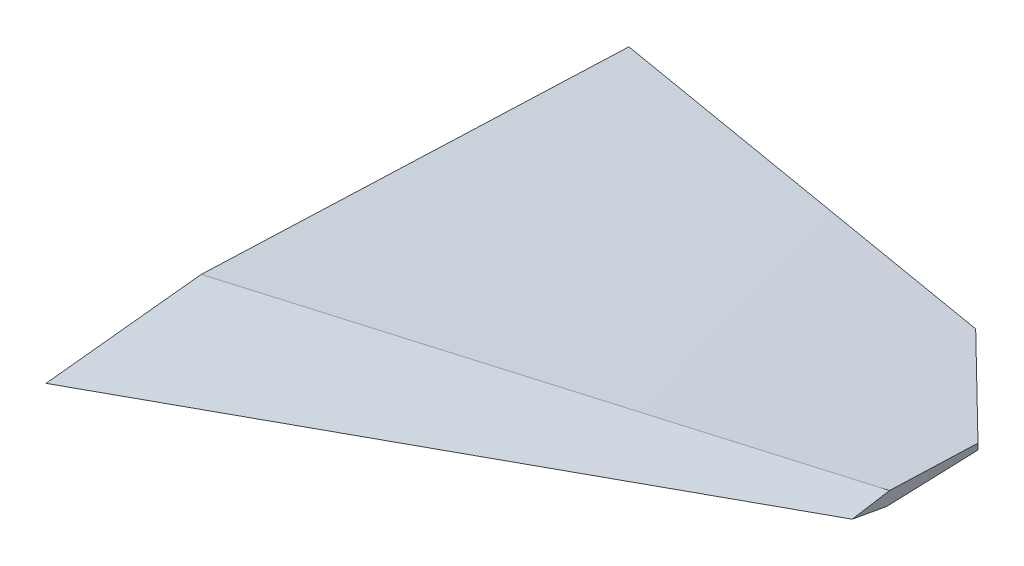
from build123d import *

# Parameters (mm, degrees)
SPLIT1_SURFACE_1_BACK  = 3090.119
SPLIT1_SURFACE_1_DEPTH = 6180.238


with BuildPart() as part:
    # Sketch1 → Loft1 section 0
    with BuildSketch(Plane(origin=(1079.999178552, 0, 0), x_dir=(0, 0, -1), z_dir=(1, 0, 0))):
        with BuildLine():
            Line((4952.5, 1865), (5602.5, 1935))
            Line((5602.5, 1935), (7392.5, 1865))
            Line((7392.5, 1865), (5602.5, 1795))
            Line((5602.5, 1795), (4952.5, 1865))
        make_face()
    # Sketch3 → Loft1 section 1
    with BuildSketch(Plane(origin=(2914.999178552, 1520, 0), x_dir=(0, 0, -1), z_dir=(0.9827811204575816, -0.18477356215687504, 0))):
        with BuildLine():
            Line((6492.5, 0), (6642.5, 32.5))
            Line((6642.5, 32.5), (7367.5, 0))
            Line((7367.5, 0), (6642.5, -32.5))
            Line((6642.5, -32.5), (6492.5, 0))
        make_face()
    loft()

    # Split1: cut with a surface, the side behind it stays
    # Split1 surface: a surface, the sketch's curves swept straight by 6180.238 mm
    with BuildLine(Plane(origin=(0, 0, 0), x_dir=(1, 0, 0), z_dir=(0, 1, 0)).offset(-SPLIT1_SURFACE_1_BACK), mode=Mode.PRIVATE) as split1_surface_1_path:
        Line((2264, 7652.5), (4524, 5452.5))
    split1_surface_1 = Shell.extrude(split1_surface_1_path.wire(), (0 * SPLIT1_SURFACE_1_DEPTH, 1 * SPLIT1_SURFACE_1_DEPTH, 0 * SPLIT1_SURFACE_1_DEPTH))
    split(bisect_by=split1_surface_1, keep=Keep.BOTTOM)


solid = part.part
